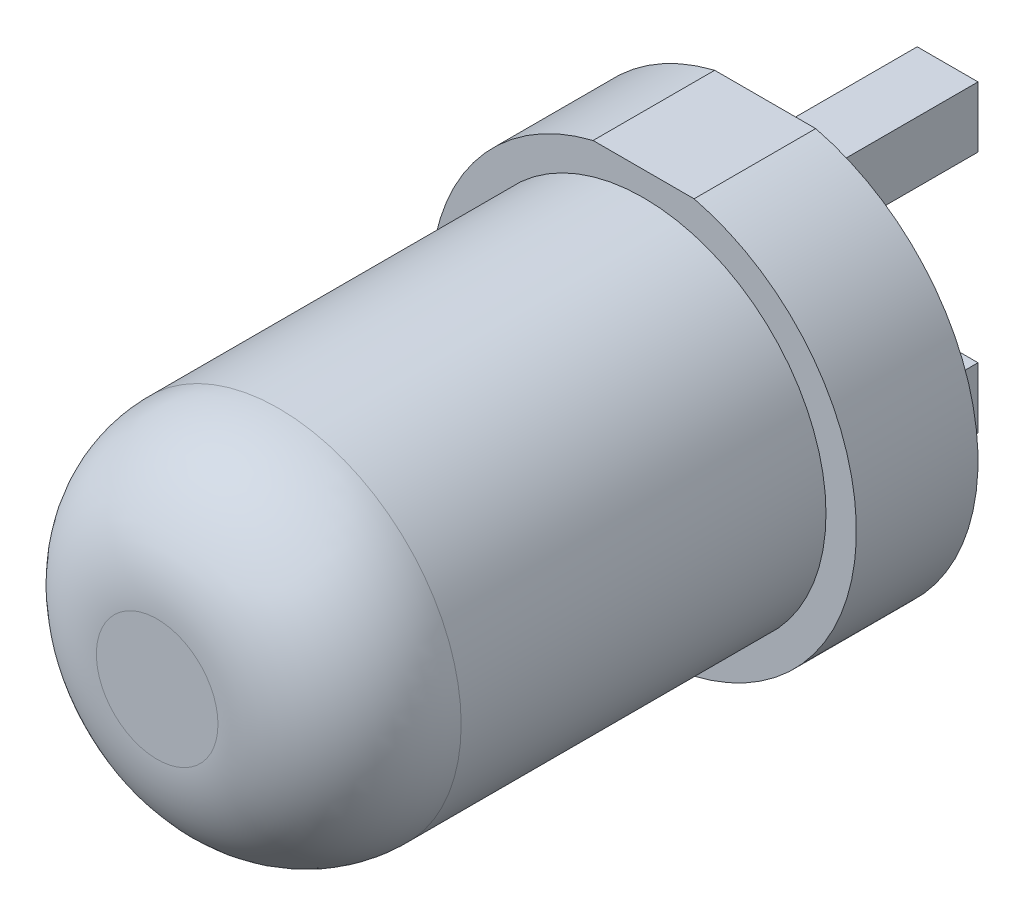
from build123d import *

# Parameters (mm, degrees)
SKETCH1_R      = 1.75
EXTRUDE1_DEPTH = 0.5
SKETCH2_R      = 1.5
EXTRUDE2_DEPTH = 4
FILLET2_R      = 1
SKETCH4_W      = 13.081078865
SKETCH4_H      = 5.810496129
EXTRUDE3_DEPTH = 1.3
SKETCH5_W      = 0.5
SKETCH5_H      = 0.5
EXTRUDE4_DEPTH = 1.5


with BuildPart() as part:
    # Sketch1 → Extrude1 (new, symmetric)
    with BuildSketch(Plane.XY):
        Circle(SKETCH1_R)
    extrude(amount=EXTRUDE1_DEPTH, both=True)

    # Sketch2 → Extrude2 (add)
    with BuildSketch(Plane.XY.offset(0.5)):
        Circle(SKETCH2_R)
    extrude(amount=EXTRUDE2_DEPTH)

    # Fillet2
    fillet2_edges = [part.edges().sort_by_distance(p)[0] for p in [
        (-1.5, 0, 4.5),
    ]]
    fillet(fillet2_edges, radius=FILLET2_R)

    # Sketch4 → Extrude3 (cut)
    with BuildSketch(Plane(origin=(0, 3, 0), x_dir=(-1, 0, 0), z_dir=(0, 1, 0))):
        with Locations((-1.941605697, 0.17278636)):
            Rectangle(SKETCH4_W, SKETCH4_H)
    extrude3 = extrude(amount=-EXTRUDE3_DEPTH, mode=Mode.SUBTRACT)

    # Sketch5 → Extrude4 (add)
    with BuildSketch(Plane(origin=(0, 0, -0.5), x_dir=(-1, 0, 0), z_dir=(0, 0, -1))):
        with Locations((0, 0.95)):
            Rectangle(SKETCH5_W, SKETCH5_H)
        with Locations((0, -1.05)):
            Rectangle(SKETCH5_W, SKETCH5_H)
    extrude(amount=EXTRUDE4_DEPTH)

    # Simetría1: Extrude3 across plane
    add(extrude3.mirror(Plane.ZX), mode=Mode.SUBTRACT)


solid = part.part
